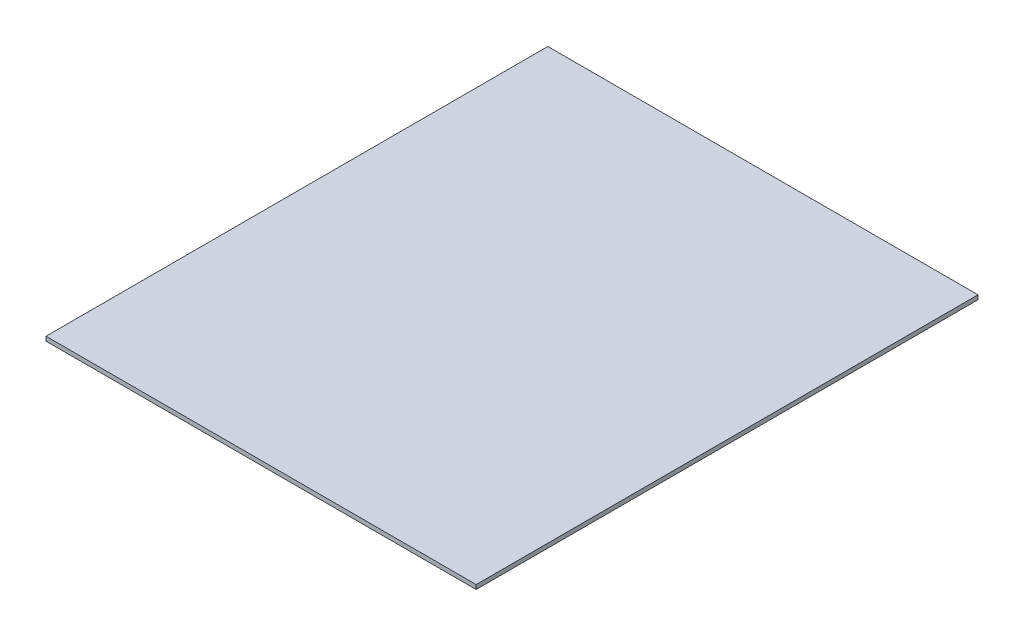
from build123d import *

# Parameters (mm, degrees)
SKETCH1_W           = 300
SKETCH1_H           = 350
BOSS_EXTRUDE1_DEPTH = 3


with BuildPart() as part:
    # Sketch1 → Boss-Extrude1 (new body)
    with BuildSketch(Plane(origin=(0, 0, 0), x_dir=(1, 0, 0), z_dir=(0, 1, 0))):
        Rectangle(SKETCH1_W, SKETCH1_H)
    extrude(amount=BOSS_EXTRUDE1_DEPTH)


solid = part.part
